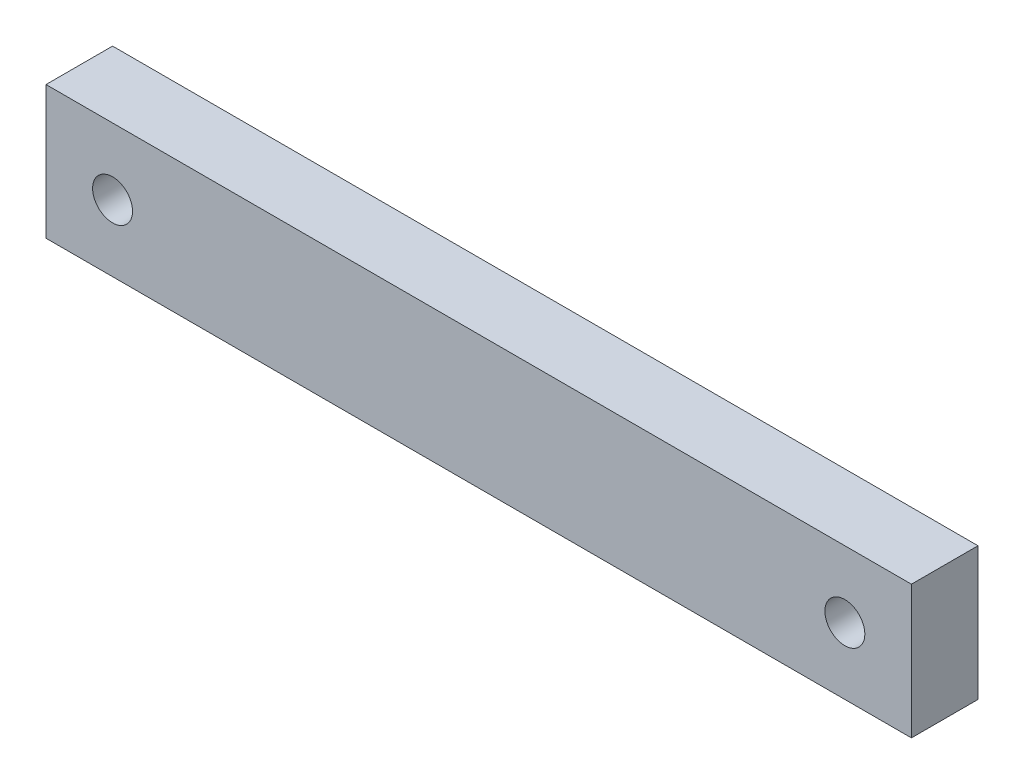
from build123d import *

# Parameters (mm, degrees)
SKETCH1_W           = 65
SKETCH1_H           = 10
SKETCH1_R           = 1.5
BOSS_EXTRUDE1_DEPTH = 5


with BuildPart() as part:
    # Sketch1 → Boss-Extrude1 (new body)
    with BuildSketch(Plane.XY):
        Rectangle(SKETCH1_W, SKETCH1_H)
        with Locations((-27.5, 0)):
            Circle(SKETCH1_R, mode=Mode.SUBTRACT)
        with Locations((27.5, 0)):
            Circle(SKETCH1_R, mode=Mode.SUBTRACT)
    extrude(amount=BOSS_EXTRUDE1_DEPTH)


solid = part.part
